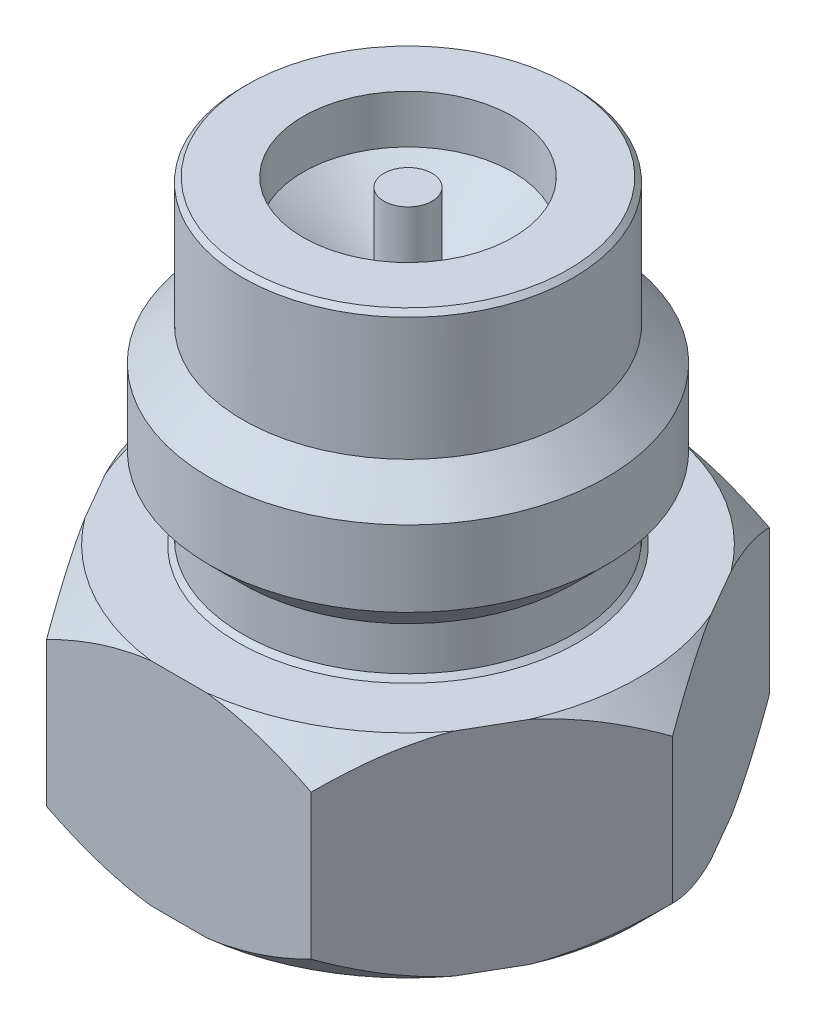
from build123d import *

# Parameters (mm, degrees)
BOSS_EXTRUDE1_DEPTH = 11.176
CHAMFER1_SIZE       = 0.254


with BuildPart() as part:
    # Sketch2 → Revolve1 (revolve)
    with BuildSketch(Plane.XY, mode=Mode.PRIVATE) as revolve1_sk:
        Polygon((0, 0), (0, 16.2941), (1.27, 16.2941), (1.27, 11.2141), (5.5245, 14.224), (5.5245, 16.764), (8.6995, 16.764), (8.6995, 10.033), (10.4521, 8.2804), (10.4521, 4.2926), (8.6995, 2.54), (8.6995, 0), align=None)
    revolve(revolve1_sk.sketch.rotate(Axis((0, 0, 0), (0, 1, 0)), 90), axis=Axis((0, 0, 0), (0, 1, 0)))

    # Sketch3 → Boss-Extrude1 (add)
    with BuildSketch(Plane.XZ):
        Polygon((13.931461996, 0), (6.965730998, 12.065), (-6.965730998, 12.065), (-13.931461996, 0), (-6.965730998, -12.065), (6.965730998, -12.065), align=None)
    extrude(amount=BOSS_EXTRUDE1_DEPTH)

    # Sketch5 → Cut-Revolve1 (revolve, cut)
    with BuildSketch(Plane.XY, mode=Mode.PRIVATE) as cut_revolve1_sk:
        Polygon((13.931461996, -1.778), (12.153461996, 0), (16.589687484, 0), (16.589687484, -11.176), (12.153461996, -11.176), (13.931461996, -9.398), align=None)
    revolve(cut_revolve1_sk.sketch.rotate(Axis((0, 0, 0), (0, -1, 0)), 90), axis=Axis((0, 0, 0), (0, -1, 0)), mode=Mode.SUBTRACT)

    # Chamfer1
    chamfer1_edges = [part.edges().sort_by_distance(p)[0] for p in [
        (0, 16.764, 8.6995),
        (0, 0, 8.6995),
    ]]
    chamfer(chamfer1_edges, length=CHAMFER1_SIZE)


solid = part.part
